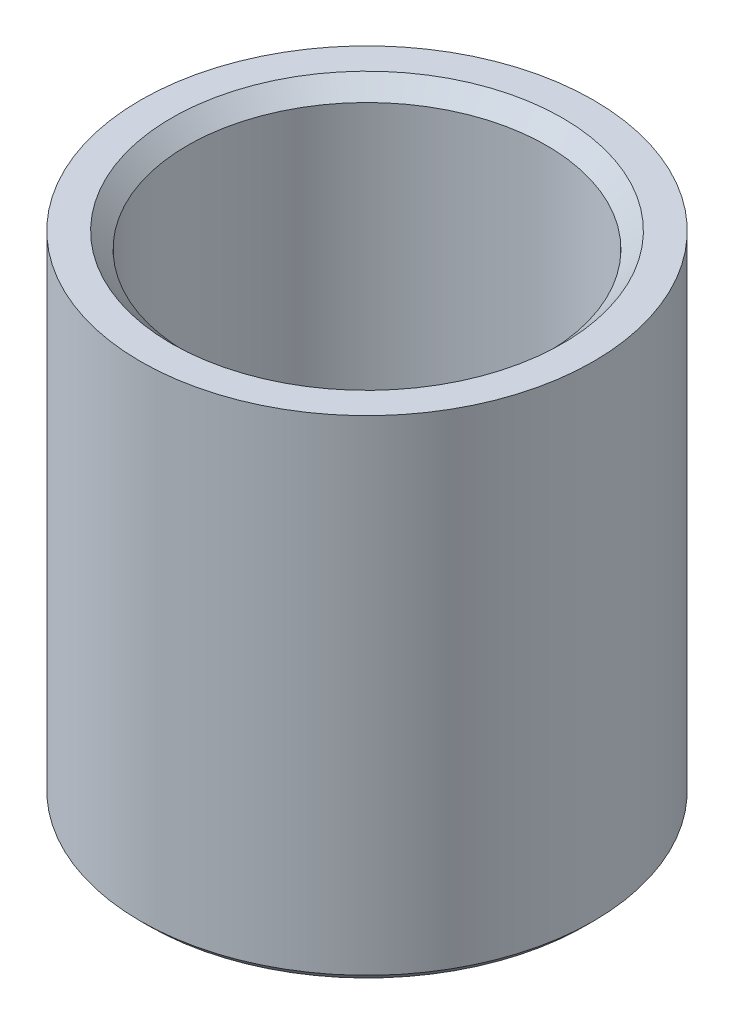
from build123d import *

# Parameters (mm, degrees)
SKETCH2_R           = 28.5
SKETCH2_R_2         = 22.6
BOSS_EXTRUDE1_DEPTH = 62
CHAMFER1_SIZE       = 2
CHAMFER2_SIZE       = 1
CHAMFER3_SIZE       = 1


with BuildPart() as part:
    # Sketch2 → Boss-Extrude1 (new body)
    with BuildSketch(Plane(origin=(0, 0, 0), x_dir=(1, 0, 0), z_dir=(0, 1, 0))):
        with Locations(Location((0, 0, 0), (0, 0, 270))):
            Circle(SKETCH2_R)
        with Locations(Location((0, 0, 0), (0, 0, 270))):
            Circle(SKETCH2_R_2, mode=Mode.SUBTRACT)
    extrude(amount=BOSS_EXTRUDE1_DEPTH)

    # Chamfer1
    chamfer1_edges = [part.edges().sort_by_distance(p)[0] for p in [
        (0, 62, -22.6),
    ]]
    chamfer(chamfer1_edges, length=CHAMFER1_SIZE)

    # Chamfer2
    chamfer2_edges = [part.edges().sort_by_distance(p)[0] for p in [
        (0, 0, -22.6),
    ]]
    chamfer(chamfer2_edges, length=CHAMFER2_SIZE)

    # Chamfer3
    chamfer3_edges = [part.edges().sort_by_distance(p)[0] for p in [
        (0, 0, -28.5),
    ]]
    chamfer(chamfer3_edges, length=CHAMFER3_SIZE)


solid = part.part
